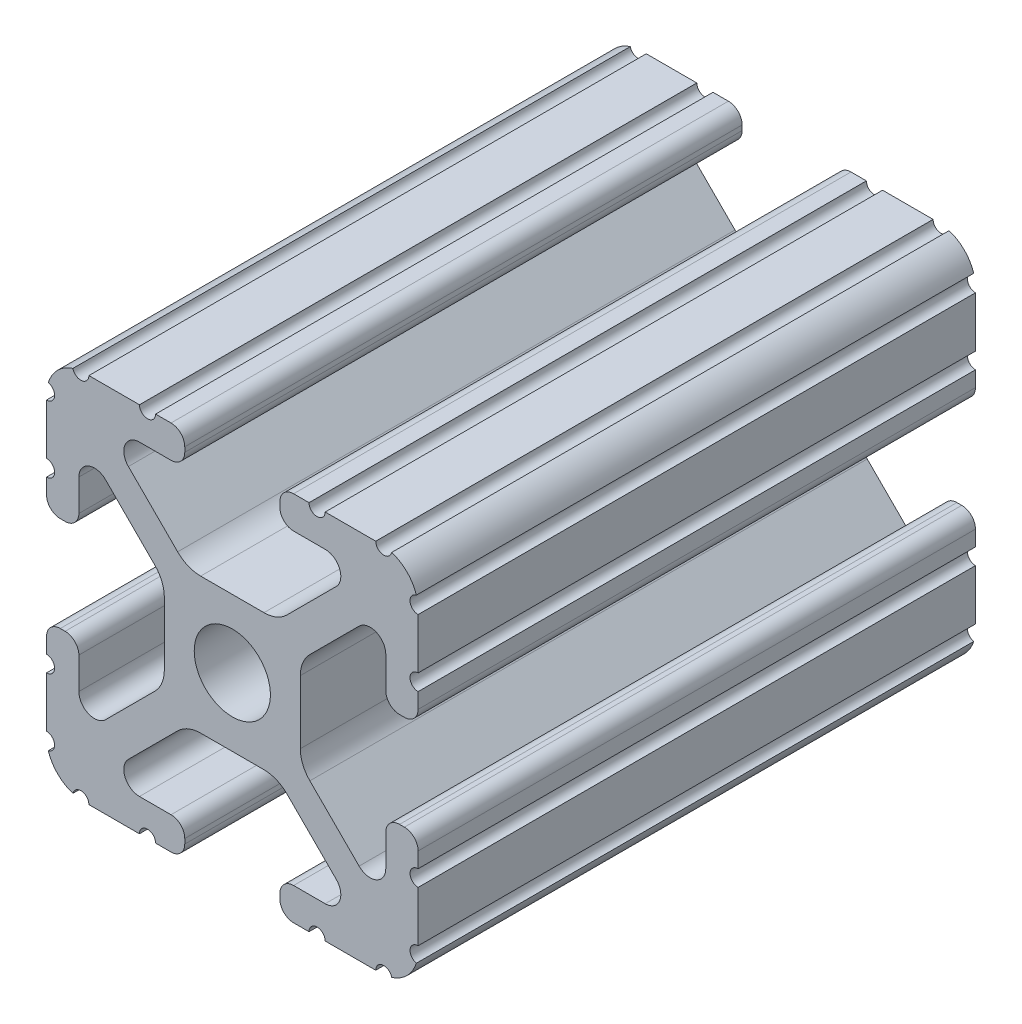
from build123d import *

# Parameters (mm, degrees)
BOSS_EXTRUDE1_DEPTH     = 76.2
CUT_EXTRUDE1_DEPTH      = 79.288057838
CUT_EXTRUDE1_DEPTH_BACK = 79.288057838
SKETCH5_R               = 0.55245
SKETCH6_W               = 25.4
SKETCH6_H               = 25.4
CUT_EXTRUDE2_DEPTH      = 79.288057838
SKETCH7_W               = 25.4
SKETCH7_H               = 25.4
CUT_EXTRUDE3_DEPTH      = 43.121134838
SKETCH9_R               = 3.2639
CUT_EXTRUDE4_DEPTH      = 82.319677815


with BuildPart() as part:
    # Sketch4 → Boss-Extrude1 (new, symmetric)
    with BuildSketch(Plane.XY):
        with BuildLine():
            Line((4.190365, -12.7), (10.11729625, -12.7))
            ThreePointArc((10.11729625, -12.7), (11.943543585, -11.943543585), (12.7, -10.11729625))
            Line((12.7, -10.11729625), (12.7, -4.190365))
            ThreePointArc((12.7, -4.190365), (12.42492494, -3.52627506), (11.760835, -3.2512))
            Line((11.760835, -3.2512), (11.429365, -3.2512))
            ThreePointArc((11.429365, -3.2512), (10.76527506, -3.52627506), (10.4902, -4.190365))
            Line((10.4902, -4.190365), (10.4902, -6.348478019))
            ThreePointArc((10.4902, -6.348478019), (9.830707141, -7.335478831), (8.666460301, -7.103895736))
            Line((8.666460301, -7.103895736), (5.299899128, -3.737334563))
            ThreePointArc((5.299899128, -3.737334563), (4.817571085, -3.015479634), (4.6482, -2.16399369))
            Line((4.6482, -2.16399369), (4.6482, 0))
            Line((4.6482, 0), (2.6035, 0))
            ThreePointArc((2.6035, 0), (1.840952505, -1.840952505), (0, -2.6035))
            Line((0, -2.6035), (0, -4.6482))
            Line((0, -4.6482), (2.16399369, -4.6482))
            ThreePointArc((2.16399369, -4.6482), (3.015479634, -4.817571085), (3.737334563, -5.299899128))
            Line((3.737334563, -5.299899128), (7.103895736, -8.666460301))
            ThreePointArc((7.103895736, -8.666460301), (7.335478831, -9.830707141), (6.348478019, -10.4902))
            Line((6.348478019, -10.4902), (4.190365, -10.4902))
            ThreePointArc((4.190365, -10.4902), (3.52627506, -10.76527506), (3.2512, -11.429365))
            Line((3.2512, -11.429365), (3.2512, -11.760835))
            ThreePointArc((3.2512, -11.760835), (3.52627506, -12.42492494), (4.190365, -12.7))
        make_face()
    extrude(amount=BOSS_EXTRUDE1_DEPTH, both=True)

    # Sketch5 → Cut-Extrude1 (cut, two sides: drawn at the far end of the back side and taken through both)
    with BuildSketch(Plane.XY.offset(-CUT_EXTRUDE1_DEPTH_BACK)):
        with Locations((10.356153152, -12.7)):
            Circle(SKETCH5_R)
        with Locations((5.796028019, -12.7)):
            Circle(SKETCH5_R)
        with Locations((12.7, -10.356153152)):
            Circle(SKETCH5_R)
        with Locations((12.7, -5.796028019)):
            Circle(SKETCH5_R)
    extrude(amount=CUT_EXTRUDE1_DEPTH + CUT_EXTRUDE1_DEPTH_BACK, mode=Mode.SUBTRACT)

    # Mirror1: part across plane


with BuildPart() as part_1:
    add(part.part)
    add(part.part.mirror(Plane(origin=(0, 0, 0), x_dir=(0, 0, 1), z_dir=(1, 0, 0))))

    # Mirror2: part across plane


with BuildPart() as part_2:
    add(part_1.part)
    add(part_1.part.mirror(Plane.ZX))

    # Sketch6 → Cut-Extrude2 (cut, through all)
    with BuildSketch(Plane(origin=(0, 0, 0), x_dir=(-1, 0, 0), z_dir=(0, 0, -1))):
        Rectangle(SKETCH6_W, SKETCH6_H)
    extrude(amount=-CUT_EXTRUDE2_DEPTH, mode=Mode.SUBTRACT)

    # Sketch7 → Cut-Extrude3 (cut, through all)
    with BuildSketch(Plane(origin=(0, 0, -38.1), x_dir=(-1, 0, 0), z_dir=(0, 0, -1))):
        Rectangle(SKETCH7_W, SKETCH7_H)
    extrude(amount=-CUT_EXTRUDE3_DEPTH, mode=Mode.SUBTRACT)

    # Sketch9 → Cut-Extrude4 (cut, through all)
    with BuildSketch(Plane.ZY.offset(12.7)):
        with Locations(Location((-50.8, 0.060001566, 0), (0, 0, 317.047487384))):
            Circle(SKETCH9_R)
    extrude(amount=-CUT_EXTRUDE4_DEPTH, mode=Mode.SUBTRACT)


solid = part_2.part
